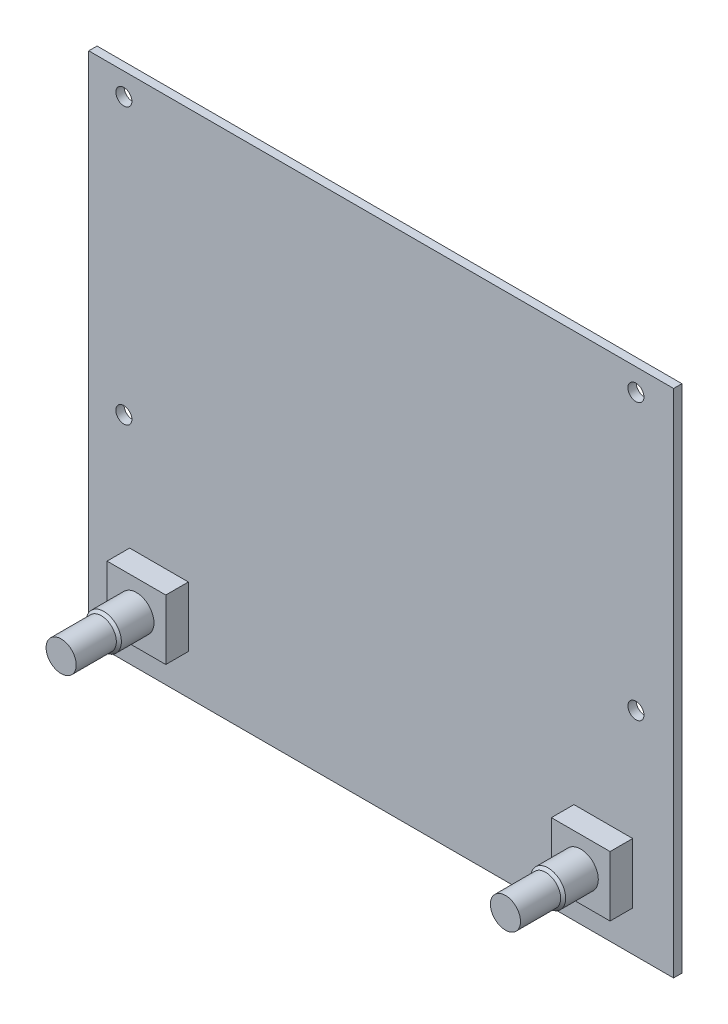
from build123d import *

# Parameters (mm, degrees)
SKETCH1_W           = 116.54028
SKETCH1_H           = 101.7397
SKETCH1_R           = 1.6002
BOSS_EXTRUDE1_DEPTH = 1.65608
SKETCH2_W           = 11.69924
SKETCH2_H           = 11.99896
BOSS_EXTRUDE2_DEPTH = 4.5
SKETCH3_R           = 3.5
BOSS_EXTRUDE3_DEPTH = 7
CHAMFER1_SIZE       = 0.5
SKETCH5_R           = 3
BOSS_EXTRUDE4_DEPTH = 8


with BuildPart() as part:
    # Sketch1 → Boss-Extrude1 (new body)
    with BuildSketch(Plane.XY):
        Rectangle(SKETCH1_W, SKETCH1_H)
        with Locations((-51.2699, 46.45025)):
            Circle(SKETCH1_R, mode=Mode.SUBTRACT)
        with Locations((50.76952, 46.45025)):
            Circle(SKETCH1_R, mode=Mode.SUBTRACT)
        with Locations((50.76952, -8.44931)):
            Circle(SKETCH1_R, mode=Mode.SUBTRACT)
        with Locations((-51.2699, -8.44931)):
            Circle(SKETCH1_R, mode=Mode.SUBTRACT)
    extrude(amount=BOSS_EXTRUDE1_DEPTH)

    # Sketch2 → Boss-Extrude2 (add)
    with BuildSketch(Plane.XY.offset(1.65608)):
        with Locations((-44.26966, -36.86937)):
            Rectangle(SKETCH2_W, SKETCH2_H)
        with Locations((44.26966, -36.86937)):
            Rectangle(SKETCH2_W, SKETCH2_H)
    extrude(amount=BOSS_EXTRUDE2_DEPTH)

    # Sketch3 → Boss-Extrude3 (add)
    with BuildSketch(Plane.XY.offset(6.15608)):
        with Locations((-44.26966, -36.86937)):
            Circle(SKETCH3_R)
        with Locations((44.26966, -36.86937)):
            Circle(SKETCH3_R)
    extrude(amount=BOSS_EXTRUDE3_DEPTH)

    # Chamfer1
    chamfer1_edges = [part.edges().sort_by_distance(p)[0] for p in [
        (-47.76966, -36.86937, 13.15608),
        (40.76966, -36.86937, 13.15608),
    ]]
    chamfer(chamfer1_edges, length=CHAMFER1_SIZE)

    # Sketch5 → Boss-Extrude4 (add)
    with BuildSketch(Plane.XY.offset(13.15608)):
        with Locations((44.26966, -36.86937)):
            Circle(SKETCH5_R)
        with Locations((-44.26966, -36.86937)):
            Circle(SKETCH5_R)
    extrude(amount=BOSS_EXTRUDE4_DEPTH)


solid = part.part
